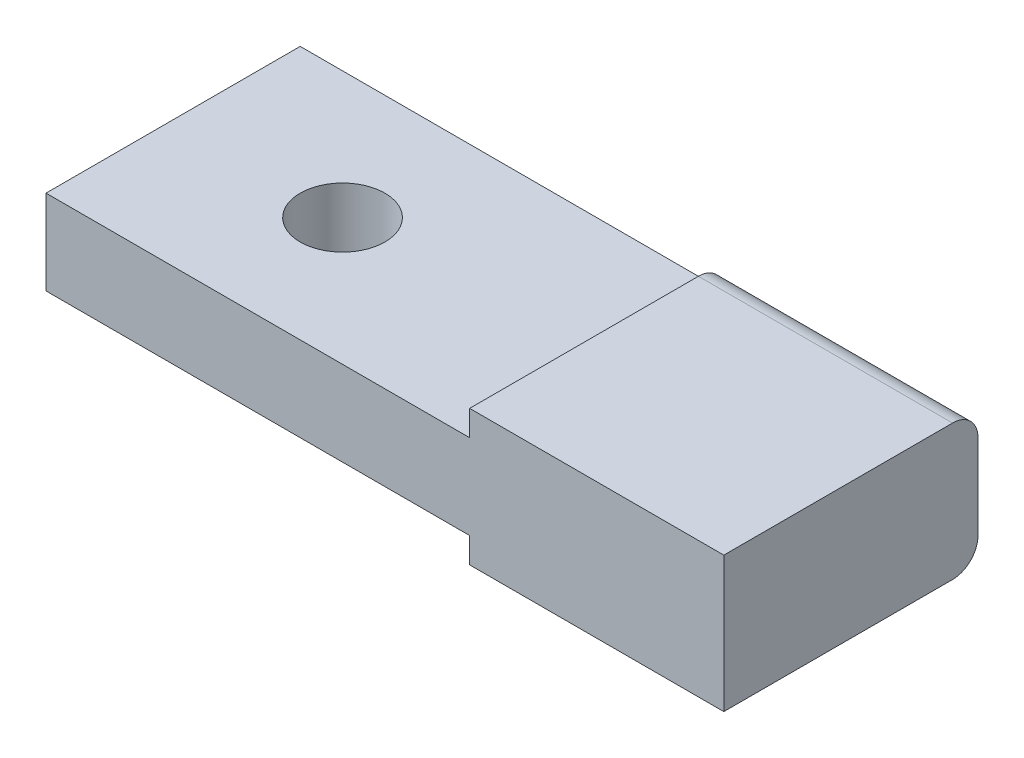
from build123d import *

# Parameters (mm, degrees)
SKETCH1_W           = 40
SKETCH1_H           = 8
BOSS_EXTRUDE1_DEPTH = 15
SKETCH2_W           = 29.034597986
SKETCH2_H           = 11.917160172
SKETCH2_W_2         = 30.589488345
SKETCH2_H_2         = 7.948253972
CUT_EXTRUDE1_DEPTH  = 15
SKETCH3_R           = 2.5
CUT_EXTRUDE2_DEPTH  = 15
FILLET1_R           = 1.5


with BuildPart() as part:
    # Sketch1 → Boss-Extrude1 (new body)
    with BuildSketch(Plane.XY):
        with Locations((20, 4)):
            Rectangle(SKETCH1_W, SKETCH1_H)
    extrude(amount=BOSS_EXTRUDE1_DEPTH)

    # Sketch2 → Cut-Extrude1 (cut)
    with BuildSketch(Plane.XY.offset(15)):
        with Locations((10.482701007, 12.458580086)):
            Rectangle(SKETCH2_W, SKETCH2_H)
        with Locations((9.705255828, -2.474126986)):
            Rectangle(SKETCH2_W_2, SKETCH2_H_2)
    extrude(amount=-CUT_EXTRUDE1_DEPTH, mode=Mode.SUBTRACT)

    # Sketch3 → Cut-Extrude2 (cut)
    with BuildSketch(Plane(origin=(0, 6.5, 0), x_dir=(1, 0, 0), z_dir=(0, 1, 0))):
        with Locations(Location((10, -7.5, 0), (0, 0, 270))):
            Circle(SKETCH3_R)
    extrude(amount=-CUT_EXTRUDE2_DEPTH, mode=Mode.SUBTRACT)

    # Fillet1
    fillet1_edges = [part.edges().sort_by_distance(p)[0] for p in [
        (32.5, 8, 0),
        (32.5, 0, 0),
    ]]
    fillet(fillet1_edges, radius=FILLET1_R)


solid = part.part
